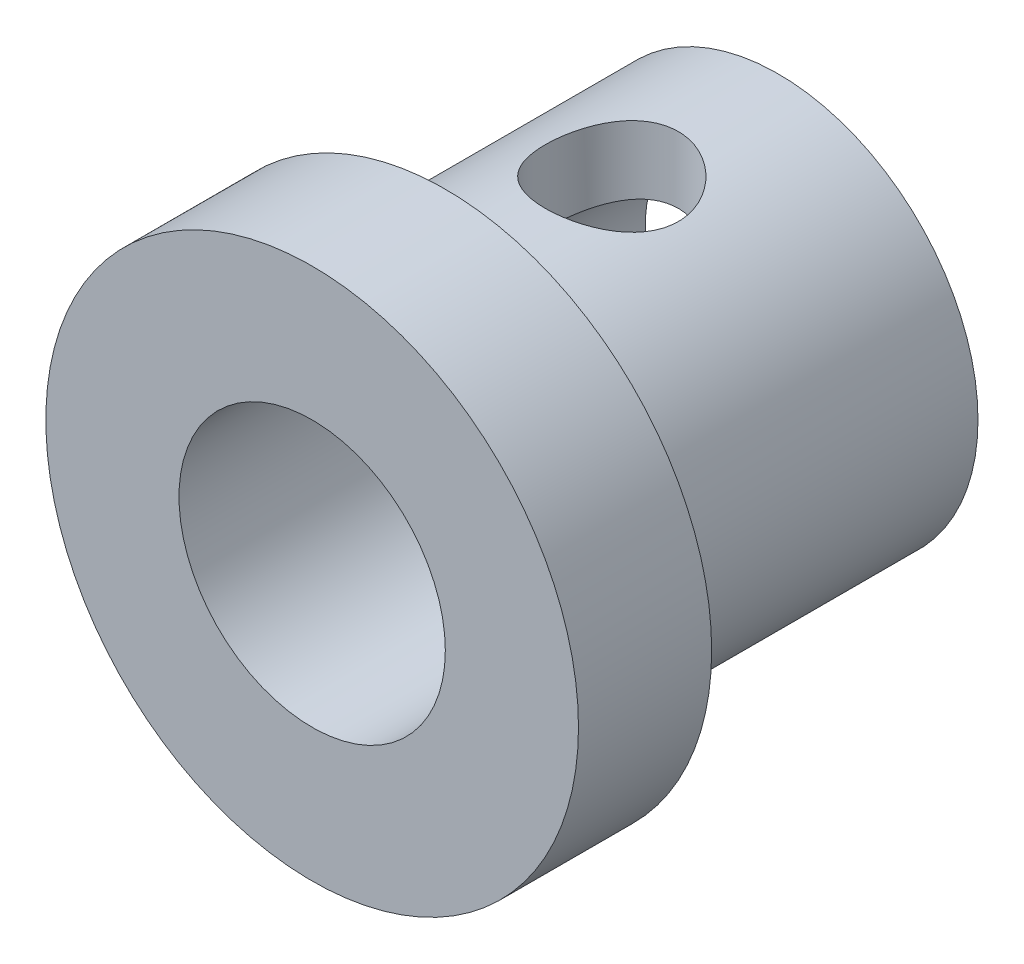
from build123d import *

# Parameters (mm, degrees)
CUT_EXTRUDE1_DEPTH      = 10
CUT_EXTRUDE1_DEPTH_BACK = 10
SKETCH2_R               = 1


with BuildPart() as part:
    # Sketch1 → Revolve1 (revolve)
    with BuildSketch(Plane(origin=(0, 0, 0), x_dir=(0, 0, -1), z_dir=(1, 0, 0)), mode=Mode.PRIVATE) as revolve1_sk:
        Polygon((0, 4), (0, 2), (7, 2), (7, 3), (2, 3), (2, 4), align=None)
    revolve(revolve1_sk.sketch.rotate(Axis((0, 0, 4.578688525), (0, 0, -1)), 90), axis=Axis((0, 0, 4.578688525), (0, 0, -1)))

    # Sketch2 → Cut-Extrude1 (cut, two sides: drawn at the far end of the back side and taken through both)
    with BuildSketch(Plane(origin=(0, 0, 0), x_dir=(1, 0, 0), z_dir=(0, 1, 0)).offset(-CUT_EXTRUDE1_DEPTH_BACK)):
        with Locations(Location((0, 4.5, 0), (0, 0, 270))):
            Circle(SKETCH2_R)
    extrude(amount=CUT_EXTRUDE1_DEPTH + CUT_EXTRUDE1_DEPTH_BACK, mode=Mode.SUBTRACT)


solid = part.part
